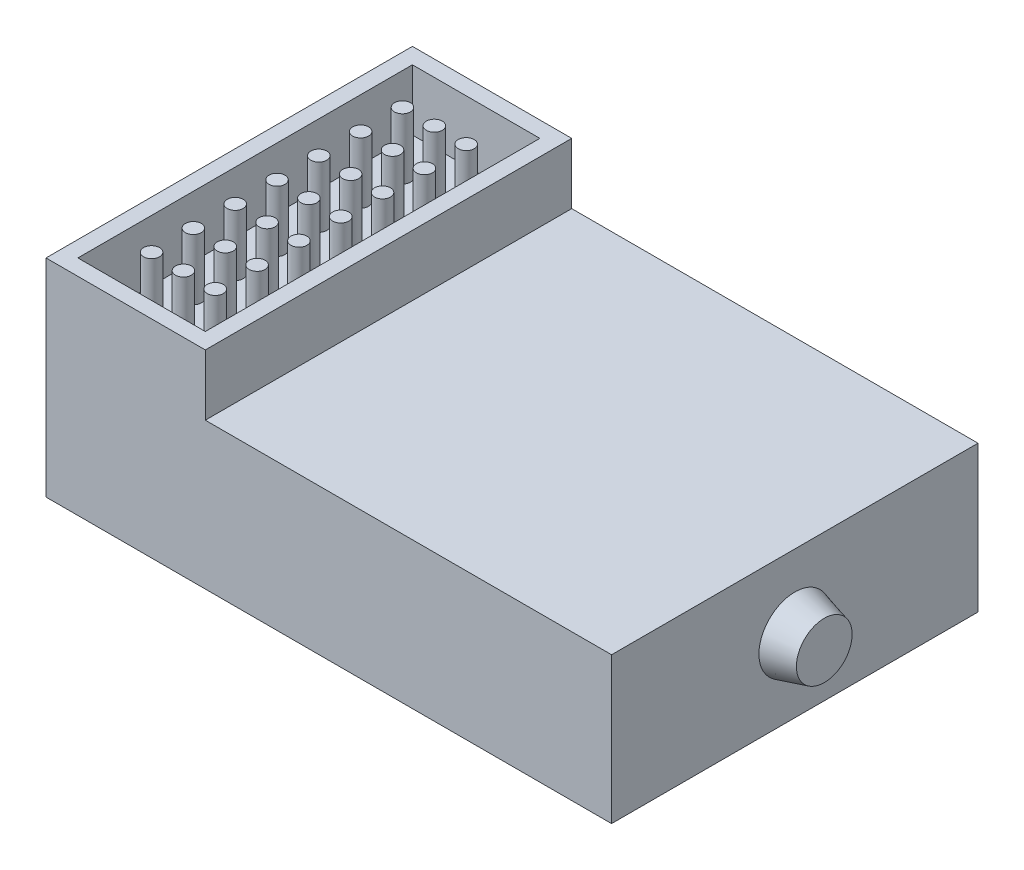
from build123d import *

# Parameters (mm, degrees)
SKETCH1_W           = 35.5
SKETCH1_H           = 23
BOSS_EXTRUDE1_DEPTH = 9.18
SKETCH2_W           = 10
SKETCH2_H           = 23
SKETCH2_W_2         = 8
SKETCH2_H_2         = 21
BOSS_EXTRUDE2_DEPTH = 3.82
SKETCH3_R           = 0.5
BOSS_EXTRUDE3_DEPTH = 3.82


with BuildPart() as part:
    # Sketch1 → Boss-Extrude1 (new body)
    with BuildSketch(Plane(origin=(0, 0, 0), x_dir=(1, 0, 0), z_dir=(0, 1, 0))):
        Rectangle(SKETCH1_W, SKETCH1_H)
    extrude(amount=BOSS_EXTRUDE1_DEPTH)

    # Sketch2 → Boss-Extrude2 (add)
    with BuildSketch(Plane(origin=(0, 9.18, 0), x_dir=(1, 0, 0), z_dir=(0, 1, 0))):
        with Locations((-12.75, 0)):
            Rectangle(SKETCH2_W, SKETCH2_H)
        with Locations((-12.75, 0)):
            Rectangle(SKETCH2_W_2, SKETCH2_H_2, mode=Mode.SUBTRACT)
    extrude(amount=BOSS_EXTRUDE2_DEPTH)

    # Sketch3 → Boss-Extrude3 (add)
    with BuildSketch(Plane(origin=(0, 9.18, 0), x_dir=(1, 0, 0), z_dir=(0, 1, 0))):
        with Locations(Location((-14.75, 7.875, 0), (0, 0, 90))):
            Circle(SKETCH3_R)
        with Locations(Location((-12.75, 7.875, 0), (0, 0, 90))):
            Circle(SKETCH3_R)
        with Locations(Location((-10.75, 7.875, 0), (0, 0, 90))):
            Circle(SKETCH3_R)
        with Locations(Location((-12.75, 5.25, 0), (0, 0, 90))):
            Circle(SKETCH3_R)
        with Locations(Location((-10.75, 5.25, 0), (0, 0, 90))):
            Circle(SKETCH3_R)
        with Locations(Location((-12.75, 2.625, 0), (0, 0, 90))):
            Circle(SKETCH3_R)
        with Locations(Location((-10.75, 2.625, 0), (0, 0, 90))):
            Circle(SKETCH3_R)
        with Locations(Location((-12.75, 0, 0), (0, 0, 90))):
            Circle(SKETCH3_R)
        with Locations(Location((-10.75, 0, 0), (0, 0, 90))):
            Circle(SKETCH3_R)
        with Locations(Location((-12.75, -2.625, 0), (0, 0, 90))):
            Circle(SKETCH3_R)
        with Locations(Location((-10.75, -2.625, 0), (0, 0, 90))):
            Circle(SKETCH3_R)
        with Locations(Location((-12.75, -5.25, 0), (0, 0, 90))):
            Circle(SKETCH3_R)
        with Locations(Location((-10.75, -5.25, 0), (0, 0, 90))):
            Circle(SKETCH3_R)
        with Locations(Location((-12.75, -7.875, 0), (0, 0, 90))):
            Circle(SKETCH3_R)
        with Locations(Location((-10.75, -7.875, 0), (0, 0, 90))):
            Circle(SKETCH3_R)
        with Locations(Location((-14.75, 5.25, 0), (0, 0, 90))):
            Circle(SKETCH3_R)
        with Locations(Location((-14.75, 2.625, 0), (0, 0, 90))):
            Circle(SKETCH3_R)
        with Locations(Location((-14.75, 0, 0), (0, 0, 90))):
            Circle(SKETCH3_R)
        with Locations(Location((-14.75, -2.625, 0), (0, 0, 90))):
            Circle(SKETCH3_R)
        with Locations(Location((-14.75, -5.25, 0), (0, 0, 90))):
            Circle(SKETCH3_R)
        with Locations(Location((-14.75, -7.875, 0), (0, 0, 90))):
            Circle(SKETCH3_R)
    extrude(amount=BOSS_EXTRUDE3_DEPTH)

    # Sketch5 → Revolve1 (revolve)
    with BuildSketch(Plane.XY, mode=Mode.PRIVATE) as revolve1_sk:
        Polygon((17.75, 4.59), (19.6, 4.59), (19.6, 6.34), (17.75, 6.84), align=None)
    revolve(revolve1_sk.sketch.rotate(Axis((17.75, 4.59, 0), (1, 0, 0)), 90), axis=Axis((17.75, 4.59, 0), (1, 0, 0)))


solid = part.part
